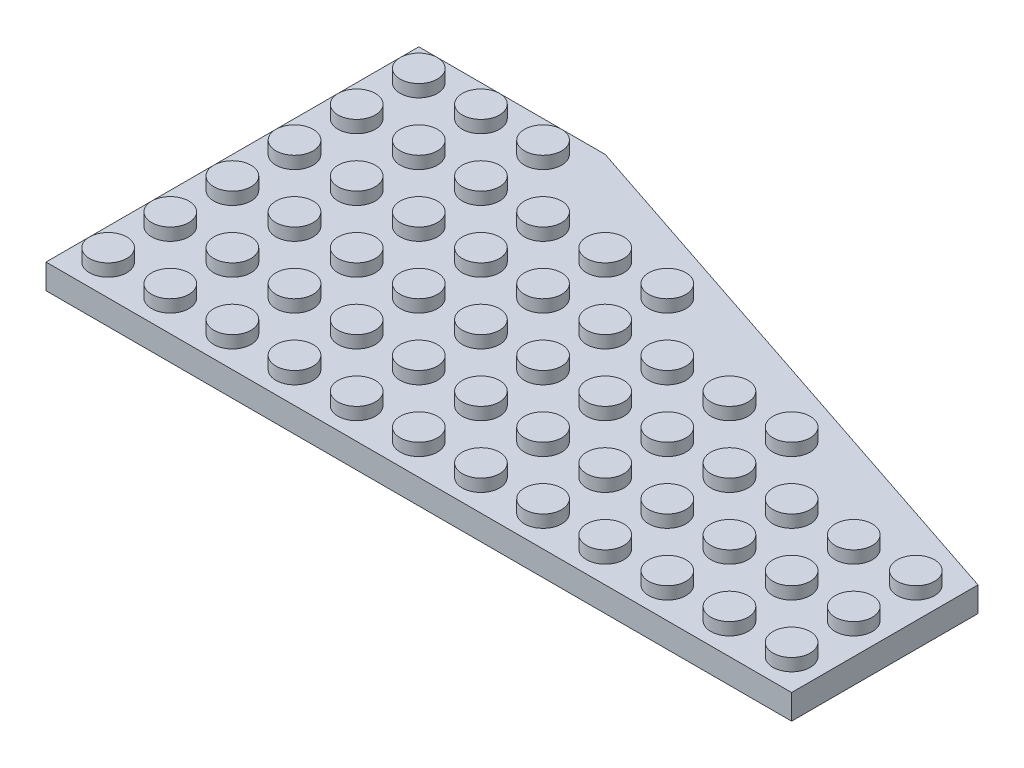
from build123d import *

# Parameters (mm, degrees)
BOSS_EXTRUDE1_DEPTH  = 3.2
SKETCH2_R            = 2.4
BOSS_EXTRUDE2_DEPTH  = 1.6
LPATTERN1_COUNT      = 6
LPATTERN1_PITCH      = 8
LPATTERN1_COUNT_DIR2 = 3
LPATTERN1_PITCH_DIR2 = 8
SKETCH3_R            = 2.4
BOSS_EXTRUDE3_DEPTH  = 1.6
LPATTERN2_COUNT      = 3
LPATTERN2_PITCH      = 8
LPATTERN2_COUNT_DIR2 = 5
LPATTERN2_PITCH_DIR2 = 8
SKETCH4_R            = 2.4
BOSS_EXTRUDE4_DEPTH  = 1.6
LPATTERN3_COUNT      = 3
LPATTERN3_PITCH      = 8
LPATTERN3_COUNT_DIR2 = 4
LPATTERN3_PITCH_DIR2 = 8
SKETCH5_R            = 2.4
BOSS_EXTRUDE5_DEPTH  = 1.6
LPATTERN4_COUNT      = 3
LPATTERN4_PITCH      = 8
LPATTERN4_COUNT_DIR2 = 3
LPATTERN4_PITCH_DIR2 = 8
SHELL1_T             = -1.6


with BuildPart() as part:
    # Sketch1 → Boss-Extrude1 (new body)
    with BuildSketch(Plane(origin=(0, 0, 0), x_dir=(1, 0, 0), z_dir=(0, 1, 0))):
        Polygon((0, 0), (96, 0), (96, 24), (24, 48), (0, 48), align=None)
    extrude(amount=BOSS_EXTRUDE1_DEPTH)

    # Sketch2 → Boss-Extrude2 (add)
    with BuildSketch(Plane(origin=(0, 3.2, 0), x_dir=(1, 0, 0), z_dir=(0, 1, 0))):
        with Locations(Location((4, 4, 0), (0, 0, 270))):
            Circle(SKETCH2_R)
    boss_extrude2 = extrude(amount=BOSS_EXTRUDE2_DEPTH)

    # LPattern1: Boss-Extrude2 6 × 3
    with Locations(*[(j * LPATTERN1_PITCH_DIR2, 0, -i * LPATTERN1_PITCH) for i in range(LPATTERN1_COUNT) for j in range(LPATTERN1_COUNT_DIR2) if (i, j) != (0, 0)]):
        add(boss_extrude2)

    # Sketch3 → Boss-Extrude3 (add)
    with BuildSketch(Plane(origin=(0, 3.2, 0), x_dir=(1, 0, 0), z_dir=(0, 1, 0))):
        with Locations(Location((28, 4, 0), (0, 0, 270))):
            Circle(SKETCH3_R)
    boss_extrude3 = extrude(amount=BOSS_EXTRUDE3_DEPTH)

    # LPattern2: Boss-Extrude3 3 × 5
    with Locations(*[(i * LPATTERN2_PITCH, 0, -j * LPATTERN2_PITCH_DIR2) for i in range(LPATTERN2_COUNT) for j in range(LPATTERN2_COUNT_DIR2) if (i, j) != (0, 0)]):
        add(boss_extrude3)

    # Sketch4 → Boss-Extrude4 (add)
    with BuildSketch(Plane(origin=(0, 3.2, 0), x_dir=(1, 0, 0), z_dir=(0, 1, 0))):
        with Locations(Location((52, 4, 0), (0, 0, 270))):
            Circle(SKETCH4_R)
    boss_extrude4 = extrude(amount=BOSS_EXTRUDE4_DEPTH)

    # LPattern3: Boss-Extrude4 3 × 4
    with Locations(*[(i * LPATTERN3_PITCH, 0, -j * LPATTERN3_PITCH_DIR2) for i in range(LPATTERN3_COUNT) for j in range(LPATTERN3_COUNT_DIR2) if (i, j) != (0, 0)]):
        add(boss_extrude4)

    # Sketch5 → Boss-Extrude5 (add)
    with BuildSketch(Plane(origin=(0, 3.2, 0), x_dir=(1, 0, 0), z_dir=(0, 1, 0))):
        with Locations(Location((76, 4, 0), (0, 0, 270))):
            Circle(SKETCH5_R)
    boss_extrude5 = extrude(amount=BOSS_EXTRUDE5_DEPTH)

    # LPattern4: Boss-Extrude5 3 × 3
    with Locations(*[(i * LPATTERN4_PITCH, 0, -j * LPATTERN4_PITCH_DIR2) for i in range(LPATTERN4_COUNT) for j in range(LPATTERN4_COUNT_DIR2) if (i, j) != (0, 0)]):
        add(boss_extrude5)

    # Shell1
    shell1_openings = [part.faces().sort_by_distance(p)[0] for p in [
        (42.461538462, 0, -20.307692308),
    ]]
    offset(amount=SHELL1_T, openings=shell1_openings, kind=Kind.INTERSECTION)


solid = part.part
